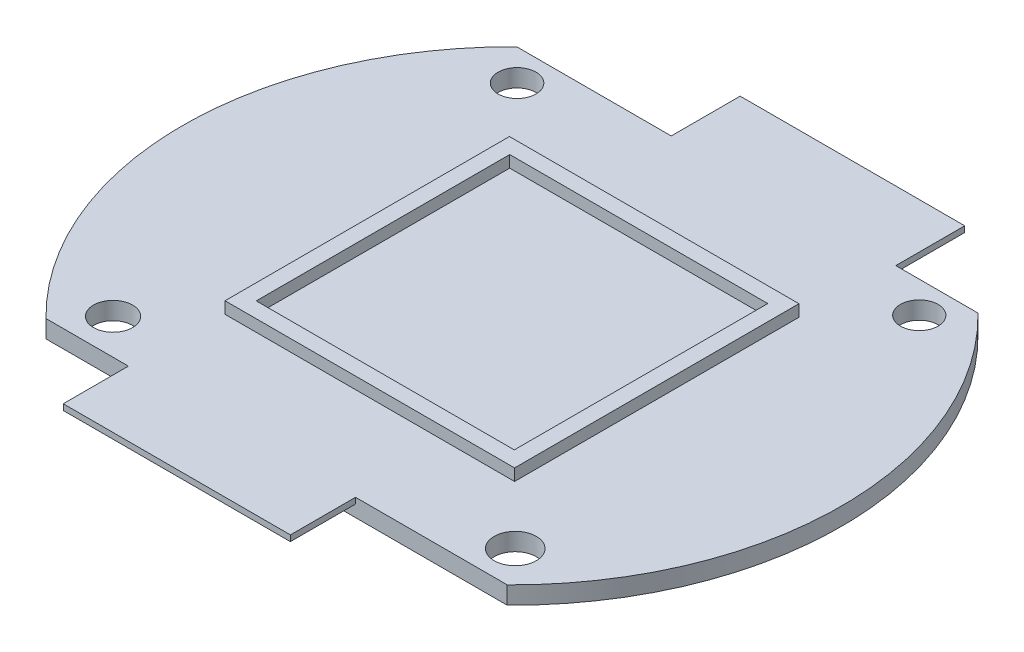
from build123d import *

# Parameters (mm, degrees)
SKETCH2_R           = 1.610129379
SKETCH2_R_2         = 1.66029091
SKETCH2_R_3         = 1.791193395
SKETCH2_R_4         = 1.600916599
BOSS_EXTRUDE1_DEPTH = 1.5
SKETCH3_W           = 19.081191899
SKETCH3_H           = 5.85855086
SKETCH3_W_2         = 19.299887508
SKETCH3_H_2         = 5.534917291
BOSS_EXTRUDE2_DEPTH = 0.5
SKETCH4_W           = 24.601924878
SKETCH4_H           = 24.16573396
SKETCH4_W_2         = 21.926940144
SKETCH4_H_2         = 21.538176574
BOSS_EXTRUDE3_DEPTH = 1


with BuildPart() as part:
    # Sketch2 → Boss-Extrude1 (new body)
    with BuildSketch(Plane(origin=(0, 0, 0), x_dir=(1, 0, 0), z_dir=(0, 1, 0))):
        with BuildLine():
            Line((8.404082058, 20), (47.595917942, 20))
            ThreePointArc((47.595917942, 20), (56, 0), (47.595917942, -20))
            Line((47.595917942, -20), (8.404082058, -20))
            ThreePointArc((8.404082058, -20), (0, 0), (8.404082058, 20))
        make_face()
        with Locations(Location((11.087651709, 17.343003221, 0), (0, 0, 270))):
            Circle(SKETCH2_R, mode=Mode.SUBTRACT)
        with Locations(Location((11.087651709, -16.98750612, 0), (0, 0, 270))):
            Circle(SKETCH2_R_2, mode=Mode.SUBTRACT)
        with Locations(Location((45.262584723, -16.98750612, 0), (0, 0, 270))):
            Circle(SKETCH2_R_3, mode=Mode.SUBTRACT)
        with Locations(Location((45.262584723, 17.343003221, 0), (0, 0, 270))):
            Circle(SKETCH2_R_4, mode=Mode.SUBTRACT)
    extrude(amount=BOSS_EXTRUDE1_DEPTH)

    # Sketch3 → Boss-Extrude2 (add)
    with BuildSketch(Plane(origin=(0, 1.5, 0), x_dir=(1, 0, 0), z_dir=(0, 1, 0))):
        with Locations((31.069199174, 22.92927543)):
            Rectangle(SKETCH3_W, SKETCH3_H)
        with Locations((25.055069922, -22.767458645)):
            Rectangle(SKETCH3_W_2, SKETCH3_H_2)
    extrude(amount=-BOSS_EXTRUDE2_DEPTH)

    # Sketch4 → Boss-Extrude3 (add)
    with BuildSketch(Plane(origin=(0, 1.5, 0), x_dir=(1, 0, 0), z_dir=(0, 1, 0))):
        with Locations((28, 0)):
            Rectangle(SKETCH4_W, SKETCH4_H)
        with Locations((28, 0)):
            Rectangle(SKETCH4_W_2, SKETCH4_H_2, mode=Mode.SUBTRACT)
    extrude(amount=BOSS_EXTRUDE3_DEPTH)


solid = part.part
